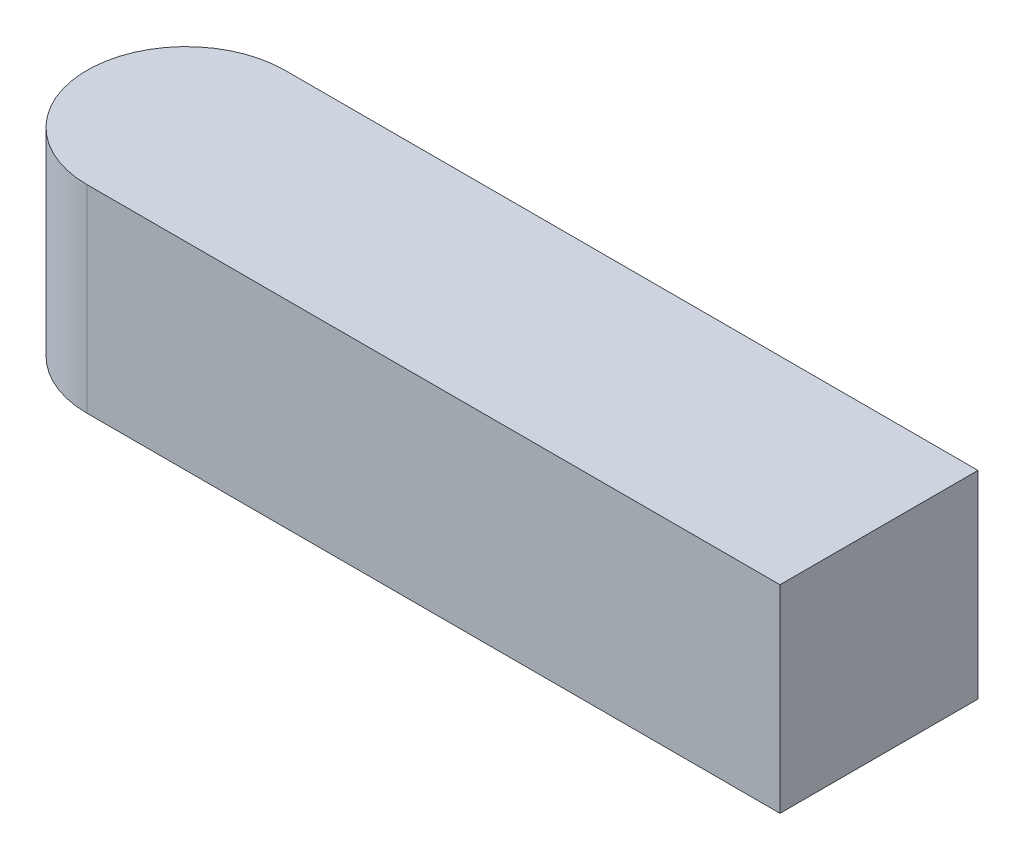
from build123d import *

# Parameters (mm, degrees)
BOSS_EXTRUDE1_DEPTH = 20
SKETCH2_W           = 80
SKETCH2_H           = 20
CUT_EXTRUDE1_DEPTH  = 84.066238629


with BuildPart() as part:
    # Sketch1 → Boss-Extrude1 (new body)
    with BuildSketch(Plane(origin=(0, 0, 0), x_dir=(1, 0, 0), z_dir=(0, 1, 0))):
        with BuildLine():
            Line((-70, 10), (70, 10))
            ThreePointArc((70, 10), (80, 0), (70, -10))
            Line((70, -10), (-70, -10))
            ThreePointArc((-70, -10), (-80, 0), (-70, 10))
        make_face()
    extrude(amount=BOSS_EXTRUDE1_DEPTH)

    # Sketch2 → Cut-Extrude1 (cut, through all)
    with BuildSketch(Plane(origin=(0, 20, 0), x_dir=(1, 0, 0), z_dir=(0, 1, 0))):
        with Locations((40, 0)):
            Rectangle(SKETCH2_W, SKETCH2_H)
    extrude(amount=-CUT_EXTRUDE1_DEPTH, mode=Mode.SUBTRACT)


solid = part.part
